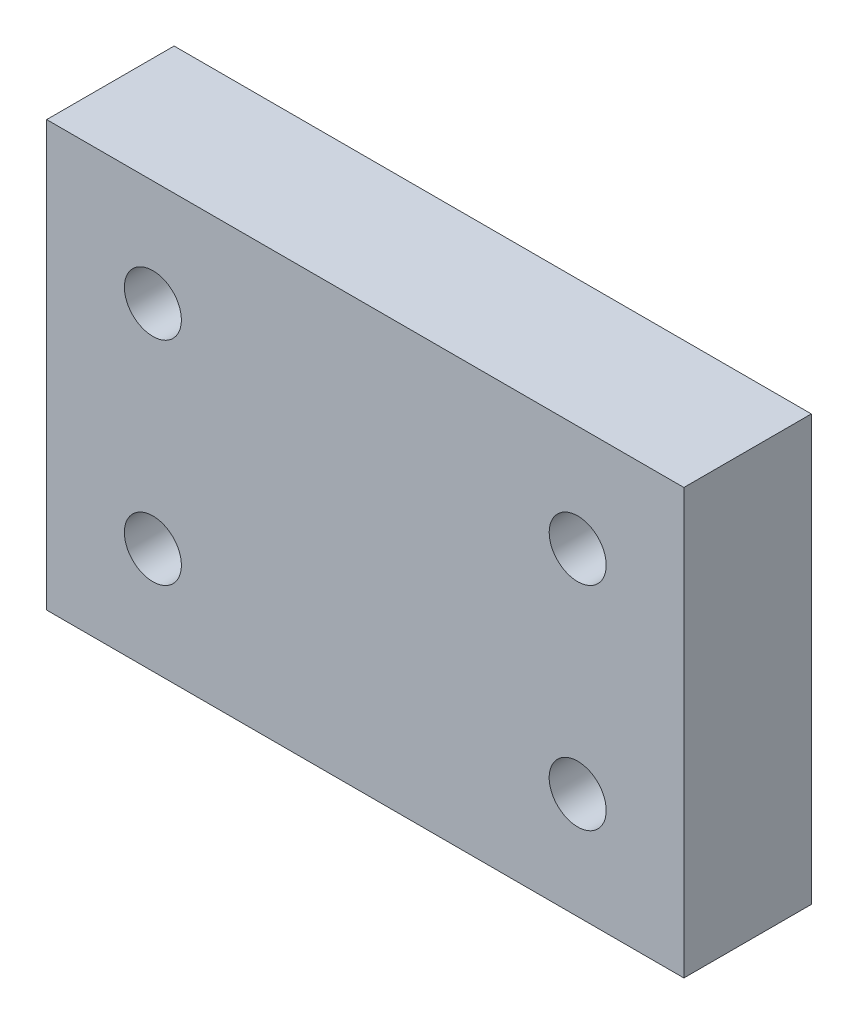
from build123d import *

# Parameters (mm, degrees)
ESQUISSE1_W        = 30
ESQUISSE1_H        = 20
ESQUISSE1_R        = 1.341808551
BOSS_EXTRU_1_DEPTH = 6


with BuildPart() as part:
    # Esquisse1 → Boss.-Extru.1 (new body)
    with BuildSketch(Plane.XY):
        with Locations((15, 10)):
            Rectangle(ESQUISSE1_W, ESQUISSE1_H)
        with Locations((5, 15)):
            Circle(ESQUISSE1_R, mode=Mode.SUBTRACT)
        with Locations(Location((25, 15, 0), (0, 0, 180))):
            Circle(ESQUISSE1_R, mode=Mode.SUBTRACT)
        with Locations((25, 5)):
            Circle(ESQUISSE1_R, mode=Mode.SUBTRACT)
        with Locations(Location((5, 5, 0), (0, 0, 180))):
            Circle(ESQUISSE1_R, mode=Mode.SUBTRACT)
    extrude(amount=BOSS_EXTRU_1_DEPTH)


solid = part.part
